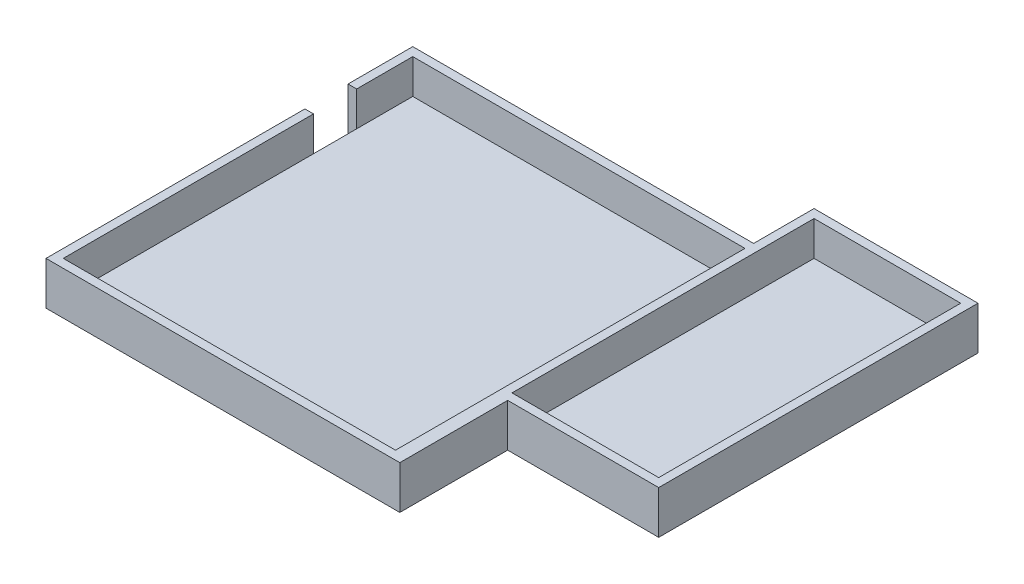
from build123d import *

# Parameters (mm, degrees)
SKETCH1_W           = 119
SKETCH1_H           = 104
BOSS_EXTRUDE1_DEPTH = 10
SKETCH2_W           = 35
SKETCH2_H           = 25
CUT_EXTRUDE1_DEPTH  = 80.650800373
SKETCH3_W           = 34
SKETCH3_H           = 70
CUT_EXTRUDE2_DEPTH  = 8
SKETCH4_W           = 77
SKETCH4_H           = 81
CUT_EXTRUDE3_DEPTH  = 8
CUT_EXTRUDE4_DEPTH  = 10
SKETCH7_W           = 10
SKETCH7_H           = 10
CUT_EXTRUDE6_DEPTH  = 2


with BuildPart() as part:
    # Sketch1 → Boss-Extrude1 (new body)
    with BuildSketch(Plane(origin=(0, 0, 0), x_dir=(1, 0, 0), z_dir=(0, 1, 0))):
        Rectangle(SKETCH1_W, SKETCH1_H)
    extrude(amount=BOSS_EXTRUDE1_DEPTH)

    # Sketch2 → Cut-Extrude1 (cut, through all)
    with BuildSketch(Plane(origin=(0, 10, 0), x_dir=(1, 0, 0), z_dir=(0, 1, 0))):
        with Locations((42, -39.5)):
            Rectangle(SKETCH2_W, SKETCH2_H)
    extrude(amount=-CUT_EXTRUDE1_DEPTH, mode=Mode.SUBTRACT)

    # Sketch3 → Cut-Extrude2 (cut)
    with BuildSketch(Plane(origin=(0, 10, 0), x_dir=(1, 0, 0), z_dir=(0, 1, 0))):
        with Locations((40.5, 10)):
            Rectangle(SKETCH3_W, SKETCH3_H)
    extrude(amount=-CUT_EXTRUDE2_DEPTH, mode=Mode.SUBTRACT)

    # Sketch4 → Cut-Extrude3 (cut)
    with BuildSketch(Plane(origin=(0, 10, 0), x_dir=(1, 0, 0), z_dir=(0, 1, 0))):
        with Locations((-17, -9.5)):
            Rectangle(SKETCH4_W, SKETCH4_H)
    extrude(amount=-CUT_EXTRUDE3_DEPTH, mode=Mode.SUBTRACT)

    # Sketch5 → Cut-Extrude4 (cut)
    with BuildSketch(Plane(origin=(0, 10, 0), x_dir=(1, 0, 0), z_dir=(0, 1, 0))):
        Polygon((-59.5, 52), (59.5, 52), (59.5, 47), (21.5, 47), (21.5, 33), (-57.5, 33), (-57.5, -52), (-59.5, -52), align=None)
    extrude(amount=-CUT_EXTRUDE4_DEPTH, mode=Mode.SUBTRACT)

    # Sketch7 → Cut-Extrude6 (cut)
    with BuildSketch(Plane.ZY.offset(57.5)):
        with Locations((-13, 5)):
            Rectangle(SKETCH7_W, SKETCH7_H)
    extrude(amount=-CUT_EXTRUDE6_DEPTH, mode=Mode.SUBTRACT)


solid = part.part
